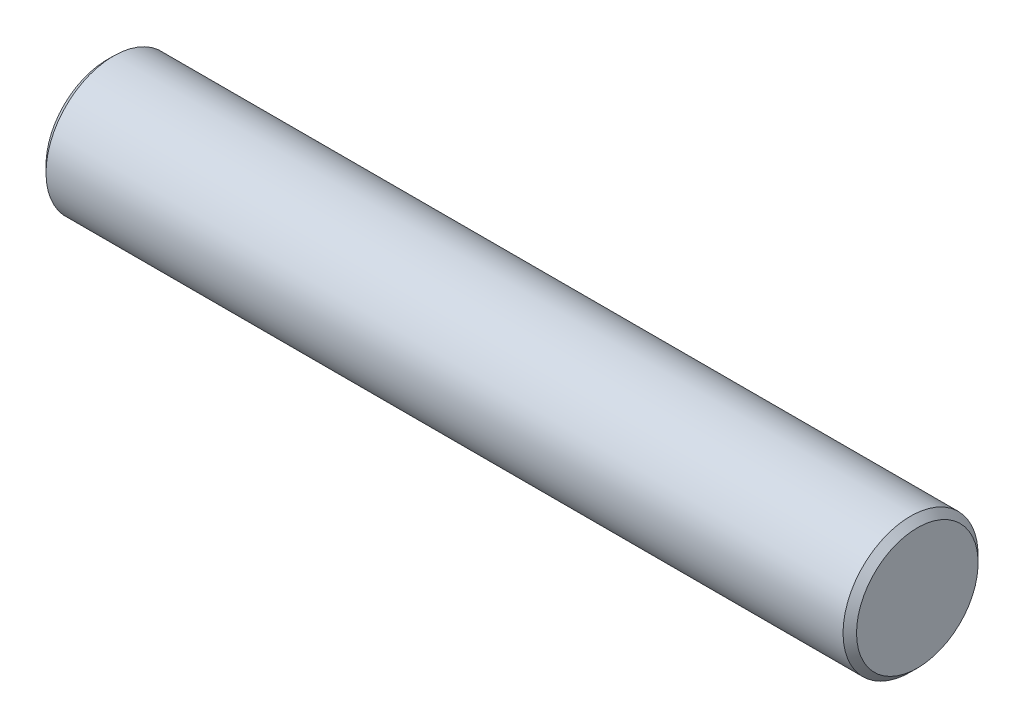
from build123d import *

# Parameters (mm, degrees)
SKETCH1_W     = 60
SKETCH1_H     = 5
CHAMFER1_SIZE = 0.5


with BuildPart() as part:
    # Sketch1 → Revolve1 (revolve)
    with BuildSketch(Plane.XY):
        with Locations((30, 2.5)):
            Rectangle(SKETCH1_W, SKETCH1_H)
    revolve(axis=Axis((0, 0, 0), (1, 0, 0)))

    # Chamfer1
    chamfer1_edges = [part.edges().sort_by_distance(p)[0] for p in [
        (60, -5, 0),
        (0, -5, 0),
    ]]
    chamfer(chamfer1_edges, length=CHAMFER1_SIZE)


solid = part.part
